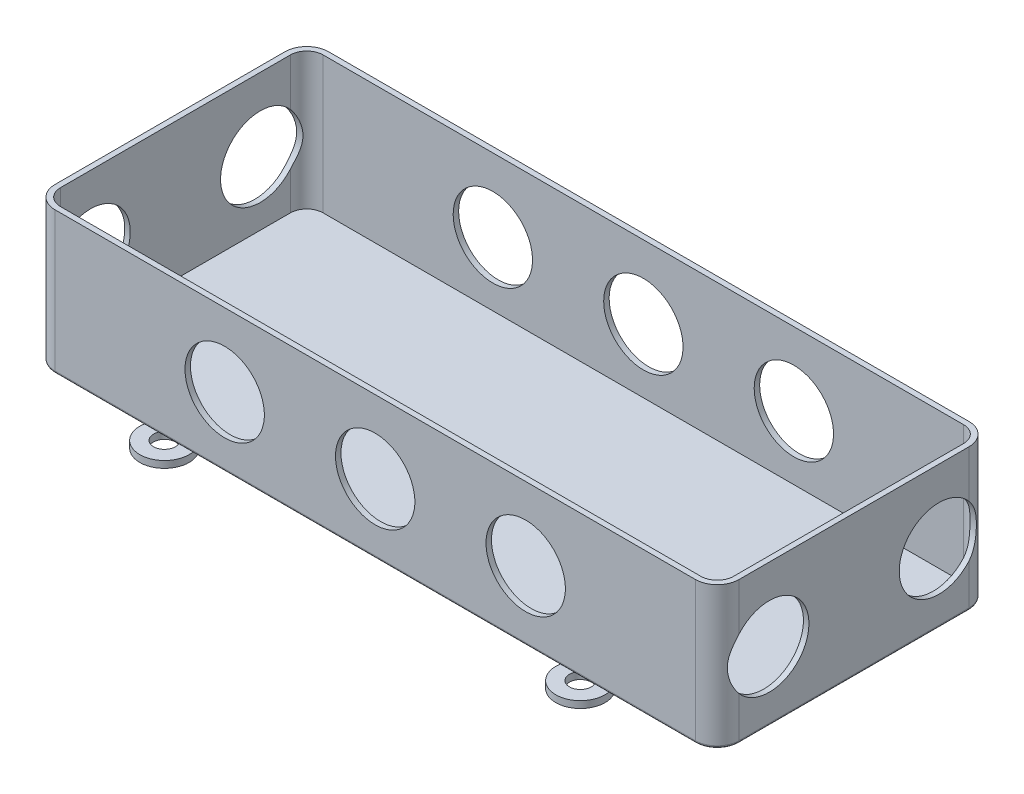
from build123d import *

# Parameters (mm, degrees)
BOSS_EXTRUDE1_DEPTH     = 52
FILLET1_R               = 1
SHELL1_T                = -2
SKETCH2_R               = 9
SKETCH2_R_2             = 4
BOSS_EXTRUDE2_DEPTH     = 2.5
SKETCH3_R               = 14.5
CUT_EXTRUDE1_DEPTH      = 175.439101121
CUT_EXTRUDE2_DEPTH      = 149.084435374
CUT_EXTRUDE2_DEPTH_BACK = 149.084435374
SKETCH4_R               = 14.5


with BuildPart() as part:
    # Sketch1 → Boss-Extrude1 (new body)
    with BuildSketch(Plane(origin=(0, 0, 0), x_dir=(1, 0, 0), z_dir=(0, 1, 0))):
        with BuildLine():
            Line((125, -42), (125, 42))
            ThreePointArc((125, 42), (122.656854249, 47.656854249), (117, 50))
            Line((117, 50), (-117, 50))
            ThreePointArc((-117, 50), (-122.656854249, 47.656854249), (-125, 42))
            Line((-125, 42), (-125, -42))
            ThreePointArc((-125, -42), (-122.656854249, -47.656854249), (-117, -50))
            Line((-117, -50), (117, -50))
            ThreePointArc((117, -50), (122.656854249, -47.656854249), (125, -42))
        make_face()
    extrude(amount=BOSS_EXTRUDE1_DEPTH)

    # Fillet1
    fillet1_edges = [part.edges().sort_by_distance(p)[0] for p in [
        (0, 0, -50),
        (122.656854249, 0, -47.656854249),
        (125, 0, 0),
        (122.656854249, 0, 47.656854249),
        (0, 0, 50),
        (-122.656854249, 0, 47.656854249),
        (-125, 0, 0),
        (-122.656854249, 0, -47.656854249),
    ]]
    fillet(fillet1_edges, radius=FILLET1_R)

    # Shell1
    shell1_openings = [part.faces().sort_by_distance(p)[0] for p in [
        (0, 52, 0),
    ]]
    offset(amount=SHELL1_T, openings=shell1_openings, kind=Kind.INTERSECTION)

    # Sketch2 → Boss-Extrude2 (add)
    # profile 1 of 4: a face of its own
    with BuildSketch(Plane.XZ):
        with Locations(Location((76, 51, 0), (0, 0, 192.839588407))):
            Circle(SKETCH2_R)
        with Locations(Location((76, 51, 0), (0, 0, 330))):
            Circle(SKETCH2_R_2, mode=Mode.SUBTRACT)
    # profile 2 of 4: a face of its own
    with BuildSketch(Plane.XZ):
        with Locations(Location((76, -51, 0), (0, 0, 90))):
            Circle(SKETCH2_R)
        with Locations(Location((76, -51, 0), (0, 0, 90))):
            Circle(SKETCH2_R_2, mode=Mode.SUBTRACT)
    # profile 3 of 4: a face of its own
    with BuildSketch(Plane.XZ):
        with Locations(Location((-76, -51, 0), (0, 0, 167.160411593))):
            Circle(SKETCH2_R)
        with Locations(Location((-76, -51, 0), (0, 0, 30))):
            Circle(SKETCH2_R_2, mode=Mode.SUBTRACT)
    # profile 4 of 4: a face of its own
    with BuildSketch(Plane.XZ):
        with Locations(Location((-76, 51, 0), (0, 0, 90))):
            Circle(SKETCH2_R)
        with Locations(Location((-76, 51, 0), (0, 0, 90))):
            Circle(SKETCH2_R_2, mode=Mode.SUBTRACT)
    extrude(amount=BOSS_EXTRUDE2_DEPTH)

    # Sketch3 → Cut-Extrude1 (cut, through all)
    with BuildSketch(Plane(origin=(0, 0, -50), x_dir=(-1, 0, 0), z_dir=(0, 0, -1))):
        with Locations((-55, 25.3)):
            Circle(SKETCH3_R)
        with Locations((0, 25.3)):
            Circle(SKETCH3_R)
        with Locations((55, 25.3)):
            Circle(SKETCH3_R)
    extrude(amount=-CUT_EXTRUDE1_DEPTH, mode=Mode.SUBTRACT)

    # Sketch4 → Cut-Extrude2 (cut, two sides: drawn at the far end of the back side and taken through both)
    with BuildSketch(Plane(origin=(0, 0, 0), x_dir=(0, 0, -1), z_dir=(1, 0, 0)).offset(-CUT_EXTRUDE2_DEPTH_BACK)):
        with Locations(Location((31, 25.3, 0), (0, 0, 40.657248638))):
            Circle(SKETCH4_R)
        with Locations(Location((-31, 25.3, 0), (0, 0, 139.342751362))):
            Circle(SKETCH4_R)
    extrude(amount=CUT_EXTRUDE2_DEPTH + CUT_EXTRUDE2_DEPTH_BACK, mode=Mode.SUBTRACT)


solid = part.part
